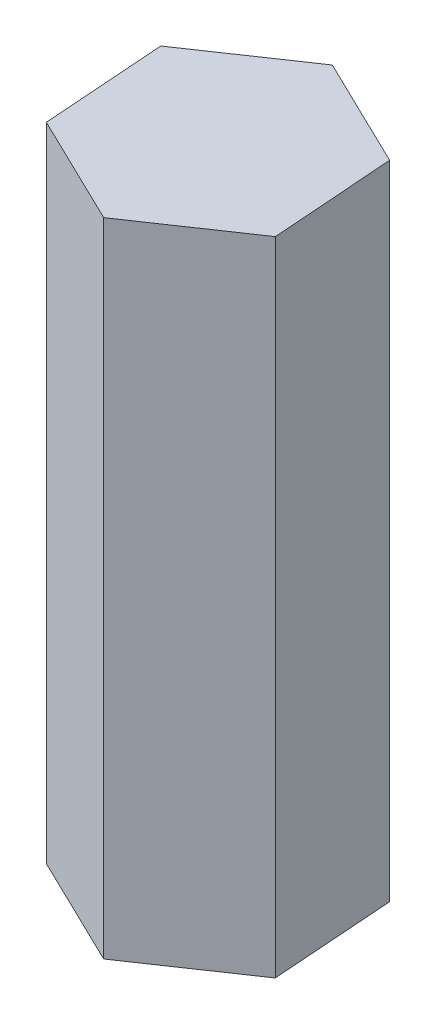
from build123d import *

# Parameters (mm, degrees)
BOSS_EXTRUDE1_DEPTH = 15


with BuildPart() as part:
    # Sketch2 → Boss-Extrude1 (new body)
    with BuildSketch(Plane(origin=(0, 0, 0), x_dir=(1, 0, 0), z_dir=(0, 1, 0))):
        Polygon((2.598022298, -1.258417051), (2.388832283, 1.620744784), (-0.209190015, 2.879161835), (-2.598022298, 1.258417051), (-2.388832283, -1.620744784), (0.209190015, -2.879161835), align=None)
    extrude(amount=BOSS_EXTRUDE1_DEPTH)


solid = part.part
